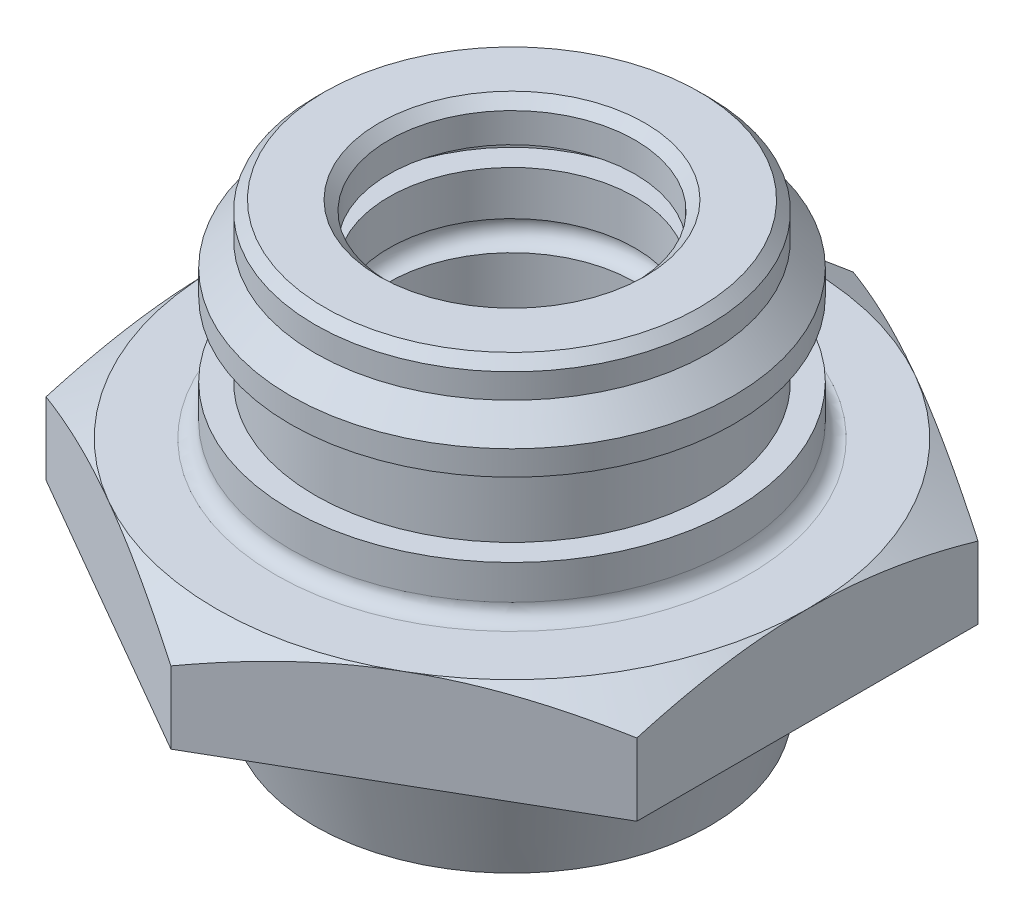
from build123d import *
from OCP.BRepFilletAPI import BRepFilletAPI_MakeChamfer

# Parameters (mm, degrees)
BOSS_EXTRUDE1_DEPTH = 20
SKETCH5_OUTSIDE_W   = 232.302
SKETCH5_OUTSIDE_H   = 250.866
SKETCH5_OUTSIDE_R   = 60
CUT_EXTRUDE1_DEPTH  = 20
CUT_EXTRUDE1_DRAFT  = -60
FILLET1_R           = 3
CHAMFER1_SIZE       = 2
CHAMFER1_SIZE2      = 2.828427125


with BuildPart() as part:
    # Sketch1 → Boss-Extrude1 (new body)
    with BuildSketch(Plane(origin=(0, 0, 0), x_dir=(1, 0, 0), z_dir=(0, 1, 0))):
        Polygon((0, 69.282032303), (-60, 34.641016151), (-60, -34.641016151), (0, -69.282032303), (60, -34.641016151), (60, 34.641016151), align=None)
    extrude(amount=BOSS_EXTRUDE1_DEPTH)

    # Sketch2 → Revolve1 (revolve)
    with BuildSketch(Plane.XY):
        Polygon((45, 50), (40, 55), (40, 62), (0, 62), (0, 20), (45, 20), (45, 30), (40, 30), (40, 45), (45, 45), align=None)
        Polygon((0, 20), (0, -30), (39.641016151, -30), (45, -10), (45, 20), align=None)
    revolve(axis=Axis((0, 20, 0), (0, 1, 0)))

    # Sketch3 → Cut-Revolve1 (revolve, cut)
    with BuildSketch(Plane.XY, mode=Mode.PRIVATE) as cut_revolve1_sk:
        with BuildLine():
            Line((25, 20), (25, 35))
            ThreePointArc((25, 35), (28, 38), (25, 41))
            Line((25, 41), (25, 50))
            Line((25, 50), (30, 50))
            Line((30, 50), (30, 54))
            Line((30, 54), (25, 54))
            Line((25, 54), (25, 62))
            Line((25, 62), (0, 62))
            Line((0, 62), (0, -30))
            Line((0, -30), (25, -30))
            Line((25, -30), (25, 6.339745962))
            Line((25, 6.339745962), (32.5, 10.669872981))
            ThreePointArc((32.5, 10.669872981), (34.829629131, 16.294095226), (30, 20))
            Line((30, 20), (25, 20))
        make_face()
    revolve(cut_revolve1_sk.sketch.rotate(Axis((0, 62, 0), (0, -1, 0)), 90), axis=Axis((0, 62, 0), (0, -1, 0)), mode=Mode.SUBTRACT)


with BuildPart() as cut_extrude1_tool:
    # Sketch5 outside → Cut-Extrude1 (with draft: the straight prism first)
    with BuildSketch(Plane(origin=(0, 20, 0), x_dir=(1, 0, 0), z_dir=(0, 1, 0))):
        Rectangle(SKETCH5_OUTSIDE_W, SKETCH5_OUTSIDE_H)
        Circle(SKETCH5_OUTSIDE_R, mode=Mode.SUBTRACT)
    extrude(amount=-CUT_EXTRUDE1_DEPTH)
    # Cut-Extrude1: the draft: its side faces are tilted about the plane it starts from
    cut_extrude1_sides = [cut_extrude1_tool.faces().sort_by_distance(p)[0] for p in [
        (0, 10, 125.433),
        (116.151, 10, 0),
        (0, 10, -125.433),
        (-116.151, 10, 0),
        (-60, 10, 0),
    ]]
    draft(cut_extrude1_sides, Plane(origin=(0, 20, 0), x_dir=(1, 0, 0), z_dir=(0, 1, 0)), CUT_EXTRUDE1_DRAFT)


with BuildPart() as part_1:
    add(part.part)

    # Cut-Extrude1: cut by cut_extrude1_tool
    add(cut_extrude1_tool.part, mode=Mode.SUBTRACT)

    # Fillet1
    fillet1_edges = [part_1.edges().sort_by_distance(p)[0] for p in [
        (-45, 20, 0),
        (-45, 0, 0),
    ]]
    fillet(fillet1_edges, radius=FILLET1_R)

    # Chamfer1: one chamfer whose edges measure the first distance from different faces: ONE call of the kernel's chamfer builder (chamfer() names one face for all edges)
    chamfer1_edges_1 = [part_1.edges().sort_by_distance(p)[0] for p in [
        (-40, 62, 0),
        (0, 62, -25),
        (0, -30, -25),
    ]]
    chamfer1_edges_2 = [part_1.edges().sort_by_distance(p)[0] for p in [
        (-39.641016151, -30, 0),
    ]]
    chamfer1_side_2 = [part_1.faces().sort_by_distance(p)[0] for p in [
        (-42.320508076, -20, 0),
    ]]
    chamfer1 = BRepFilletAPI_MakeChamfer(part_1.part.solid().wrapped)
    for e in chamfer1_edges_1:
        chamfer1.Add(CHAMFER1_SIZE, e.wrapped)
    for e in chamfer1_edges_2:
        chamfer1.Add(CHAMFER1_SIZE, CHAMFER1_SIZE2, e.wrapped, chamfer1_side_2[0].wrapped)  # the first distance lies on this face
    add(Compound.cast(chamfer1.Shape()), mode=Mode.REPLACE)


solid = part_1.part
